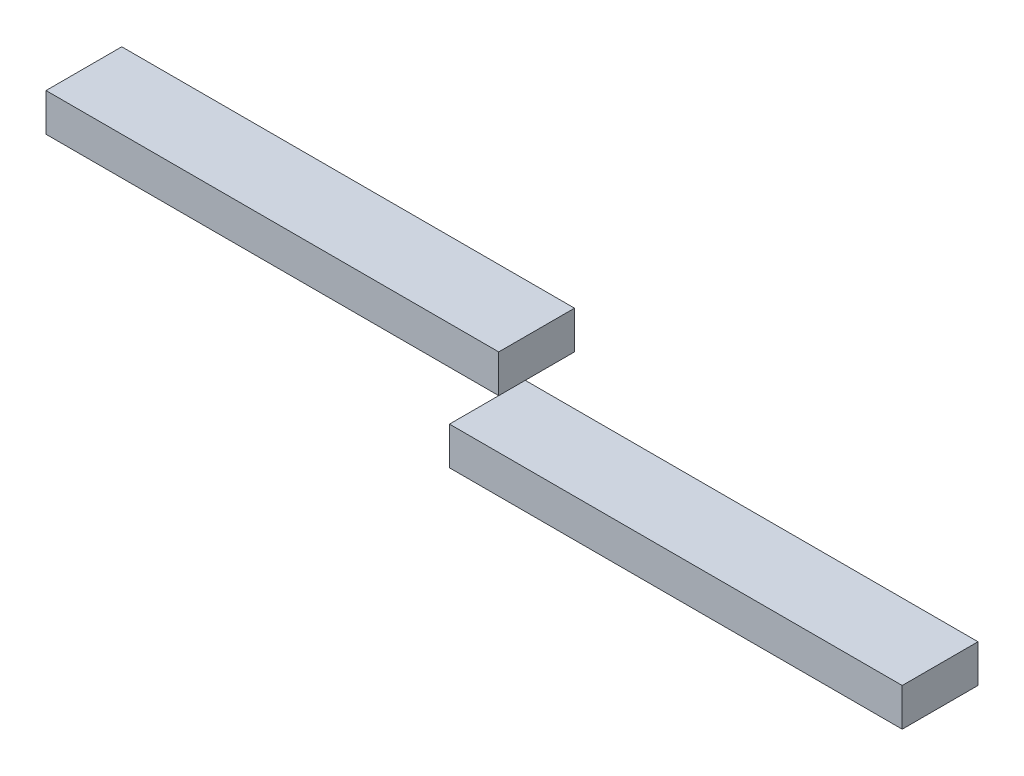
from build123d import *

# Parameters (mm, degrees)
SKETCH1_W             = 30.353
SKETCH1_H             = 5.08
BOSS_EXTRUDE1_DEPTH   = 2.54
BOSS_EXTRUDE1_2_DEPTH = 2.54


with BuildPart() as part:
    # Sketch1 → Boss-Extrude1 (new body)
    with BuildSketch(Plane(origin=(0, 0, 0), x_dir=(1, 0, 0), z_dir=(0, 1, 0))):
        with Locations((-41.73660113, 11.982817441)):
            Rectangle(SKETCH1_W, SKETCH1_H)
    extrude(amount=BOSS_EXTRUDE1_DEPTH)


with BuildPart() as body_2:
    # Sketch1 → Boss-Extrude1 2 (new body)
    with BuildSketch(Plane(origin=(0, 0, 0), x_dir=(1, 0, 0), z_dir=(0, 1, 0))):
        with Locations((-8.84360113, 6.140817441)):
            Rectangle(SKETCH1_W, SKETCH1_H)
    extrude(amount=BOSS_EXTRUDE1_2_DEPTH)


solid = Compound([part.part, body_2.part])
